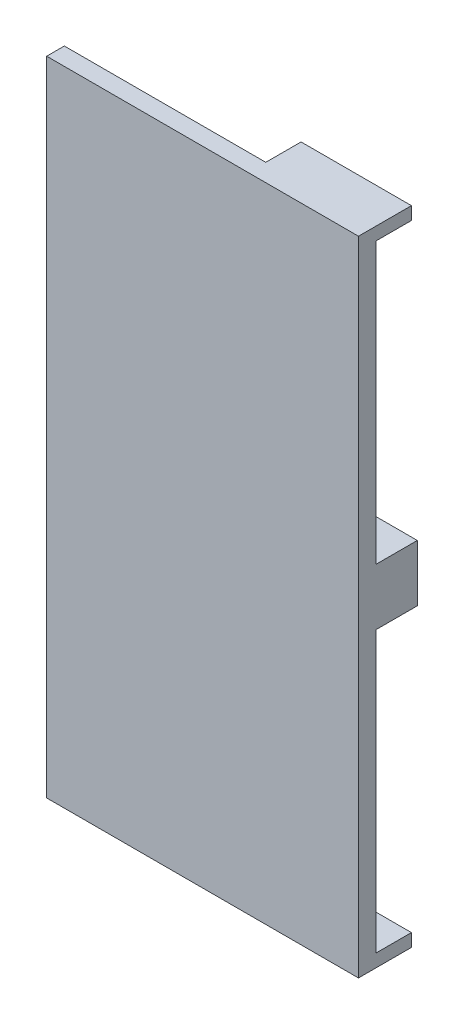
from build123d import *

# Parameters (mm, degrees)
SKETCH_1_W      = 26.5
SKETCH_1_H      = 54.6
EXTRUDE_1_DEPTH = 1.5
SKETCH_3_W      = 9.37884322
SKETCH_3_H      = 1.093530985
EXTRUDE_2_DEPTH = 3
SKETCH_4_W      = 9.519823585
SKETCH_4_H      = 4.812938029
SKETCH_4_W_2    = 7.971209668
SKETCH_4_H_2    = 13
EXTRUDE_3_DEPTH = 3.5


with BuildPart() as part:
    # ｽｹｯﾁ1 → ﾎﾞｽ - 押し出し1 (new body)
    with BuildSketch(Plane.XY):
        with Locations((29.00738196, 33.991909398)):
            Rectangle(SKETCH_1_W, SKETCH_1_H)
    extrude(amount=EXTRUDE_1_DEPTH)

    # ｽｹｯﾁ3 → ﾎﾞｽ - 押し出し2 (add)
    with BuildSketch(Plane(origin=(0, 0, 0), x_dir=(-1, 0, 0), z_dir=(0, 0, -1))):
        with Locations((-37.56796035, 60.745143906)):
            Rectangle(SKETCH_3_W, SKETCH_3_H)
    extrude_2 = extrude(amount=EXTRUDE_2_DEPTH)

    # ﾐﾗｰ1: ﾎﾞｽ - 押し出し2 across plane
    add(extrude_2.mirror(Plane(origin=(0, 33.991909398, 0), x_dir=(0, 0, 1), z_dir=(0, -1, 0))))

    # ｽｹｯﾁ4 → ﾎﾞｽ - 押し出し3 (add)
    with BuildSketch(Plane(origin=(0, 0, 0), x_dir=(-1, 0, 0), z_dir=(0, 0, -1))):
        with Locations((-37.497470167, 33.991909398)):
            Rectangle(SKETCH_4_W, SKETCH_4_H)
        with Locations((-19.742986794, 33.991909398)):
            Rectangle(SKETCH_4_W_2, SKETCH_4_H_2)
    extrude(amount=EXTRUDE_3_DEPTH)


solid = part.part
